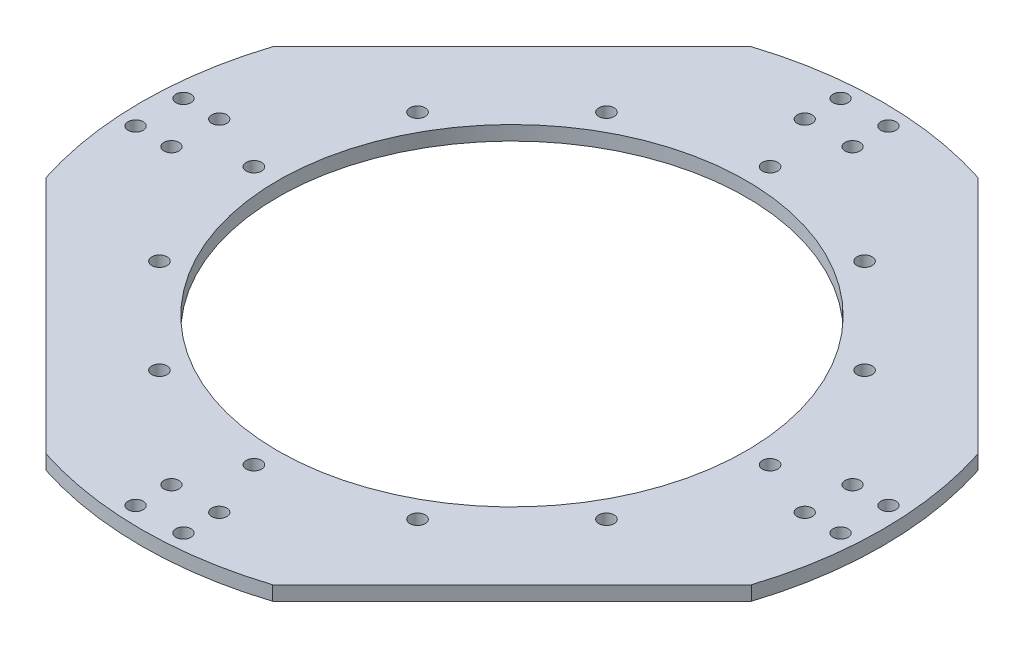
from build123d import *

# Parameters (mm, degrees)
SKETCH_1_R          = 77.5
SKETCH_1_R_2        = 49
SKETCH_1_R_3        = 1.6
SKETCH_1_R_4        = 1.575
EXTRUDE_1_DEPTH     = 3
CUT_EXTRUDE_1_DEPTH = 10


with BuildPart() as part:
    # 草图1 → 凸台-拉伸1 (new body)
    with BuildSketch(Plane(origin=(0, 0, 0), x_dir=(1, 0, 0), z_dir=(0, 1, 0))):
        with Locations(Location((0, 0, 0), (0, 0, 270))):
            Circle(SKETCH_1_R)
        with Locations(Location((0, 0, 0), (0, 0, 270))):
            Circle(SKETCH_1_R_2, mode=Mode.SUBTRACT)
        with Locations(Location((0, 54, 0), (0, 0, 270))):
            Circle(SKETCH_1_R_3, mode=Mode.SUBTRACT)
        with Locations(Location((27, 46.765371804, 0), (0, 0, 270))):
            Circle(SKETCH_1_R_3, mode=Mode.SUBTRACT)
        with Locations(Location((46.765371804, 27, 0), (0, 0, 270))):
            Circle(SKETCH_1_R_3, mode=Mode.SUBTRACT)
        with Locations(Location((54, 0, 0), (0, 0, 270))):
            Circle(SKETCH_1_R_3, mode=Mode.SUBTRACT)
        with Locations(Location((46.765371804, -27, 0), (0, 0, 270))):
            Circle(SKETCH_1_R_3, mode=Mode.SUBTRACT)
        with Locations(Location((27, -46.765371804, 0), (0, 0, 270))):
            Circle(SKETCH_1_R_3, mode=Mode.SUBTRACT)
        with Locations(Location((0, -54, 0), (0, 0, 270))):
            Circle(SKETCH_1_R_3, mode=Mode.SUBTRACT)
        with Locations(Location((-27, -46.765371804, 0), (0, 0, 270))):
            Circle(SKETCH_1_R_3, mode=Mode.SUBTRACT)
        with Locations(Location((-46.765371804, -27, 0), (0, 0, 270))):
            Circle(SKETCH_1_R_3, mode=Mode.SUBTRACT)
        with Locations(Location((-54, 0, 0), (0, 0, 270))):
            Circle(SKETCH_1_R_3, mode=Mode.SUBTRACT)
        with Locations(Location((-46.765371804, 27, 0), (0, 0, 270))):
            Circle(SKETCH_1_R_3, mode=Mode.SUBTRACT)
        with Locations(Location((-27, 46.765371804, 0), (0, 0, 270))):
            Circle(SKETCH_1_R_3, mode=Mode.SUBTRACT)
        with Locations(Location((-73.75, 5, 0), (0, 0, 270))):
            Circle(SKETCH_1_R_4, mode=Mode.SUBTRACT)
        with Locations(Location((-66.25, 5, 0), (0, 0, 90))):
            Circle(SKETCH_1_R_4, mode=Mode.SUBTRACT)
        with Locations(Location((-66.25, -5, 0), (0, 0, 270))):
            Circle(SKETCH_1_R_4, mode=Mode.SUBTRACT)
        with Locations(Location((-73.75, -5, 0), (0, 0, 90))):
            Circle(SKETCH_1_R_4, mode=Mode.SUBTRACT)
        with Locations(Location((5, 73.75, 0), (0, 0, 270))):
            Circle(SKETCH_1_R_4, mode=Mode.SUBTRACT)
        with Locations(Location((5, 66.25, 0), (0, 0, 90))):
            Circle(SKETCH_1_R_4, mode=Mode.SUBTRACT)
        with Locations(Location((-5, 66.25, 0), (0, 0, 270))):
            Circle(SKETCH_1_R_4, mode=Mode.SUBTRACT)
        with Locations(Location((-5, 73.75, 0), (0, 0, 90))):
            Circle(SKETCH_1_R_4, mode=Mode.SUBTRACT)
        with Locations(Location((73.75, -5, 0), (0, 0, 270))):
            Circle(SKETCH_1_R_4, mode=Mode.SUBTRACT)
        with Locations(Location((66.25, -5, 0), (0, 0, 90))):
            Circle(SKETCH_1_R_4, mode=Mode.SUBTRACT)
        with Locations(Location((66.25, 5, 0), (0, 0, 270))):
            Circle(SKETCH_1_R_4, mode=Mode.SUBTRACT)
        with Locations(Location((73.75, 5, 0), (0, 0, 90))):
            Circle(SKETCH_1_R_4, mode=Mode.SUBTRACT)
        with Locations(Location((-5, -73.75, 0), (0, 0, 270))):
            Circle(SKETCH_1_R_4, mode=Mode.SUBTRACT)
        with Locations(Location((-5, -66.25, 0), (0, 0, 90))):
            Circle(SKETCH_1_R_4, mode=Mode.SUBTRACT)
        with Locations(Location((5, -66.25, 0), (0, 0, 270))):
            Circle(SKETCH_1_R_4, mode=Mode.SUBTRACT)
        with Locations(Location((5, -73.75, 0), (0, 0, 90))):
            Circle(SKETCH_1_R_4, mode=Mode.SUBTRACT)
    extrude(amount=EXTRUDE_1_DEPTH)

    # 草图2 → 切除-拉伸1 (cut)
    with BuildSketch(Plane.XZ):
        with BuildLine():
            ThreePointArc((73.781230493, 23.718769507), (54.800775542, 54.800775542), (23.718769507, 73.781230493))
            Line((23.718769507, 73.781230493), (73.781230493, 23.718769507))
        make_face()
        with BuildLine():
            Line((73.781230493, -23.718769507), (23.718769507, -73.781230493))
            ThreePointArc((23.718769507, -73.781230493), (54.800775542, -54.800775542), (73.781230493, -23.718769507))
        make_face()
        with BuildLine():
            Line((-73.781230493, 23.718769507), (-23.718769507, 73.781230493))
            ThreePointArc((-23.718769507, 73.781230493), (-54.800775542, 54.800775542), (-73.781230493, 23.718769507))
        make_face()
        with BuildLine():
            Line((-23.718769507, -73.781230493), (-73.781230493, -23.718769507))
            ThreePointArc((-73.781230493, -23.718769507), (-54.800775542, -54.800775542), (-23.718769507, -73.781230493))
        make_face()
    extrude(amount=-CUT_EXTRUDE_1_DEPTH, mode=Mode.SUBTRACT)


solid = part.part
